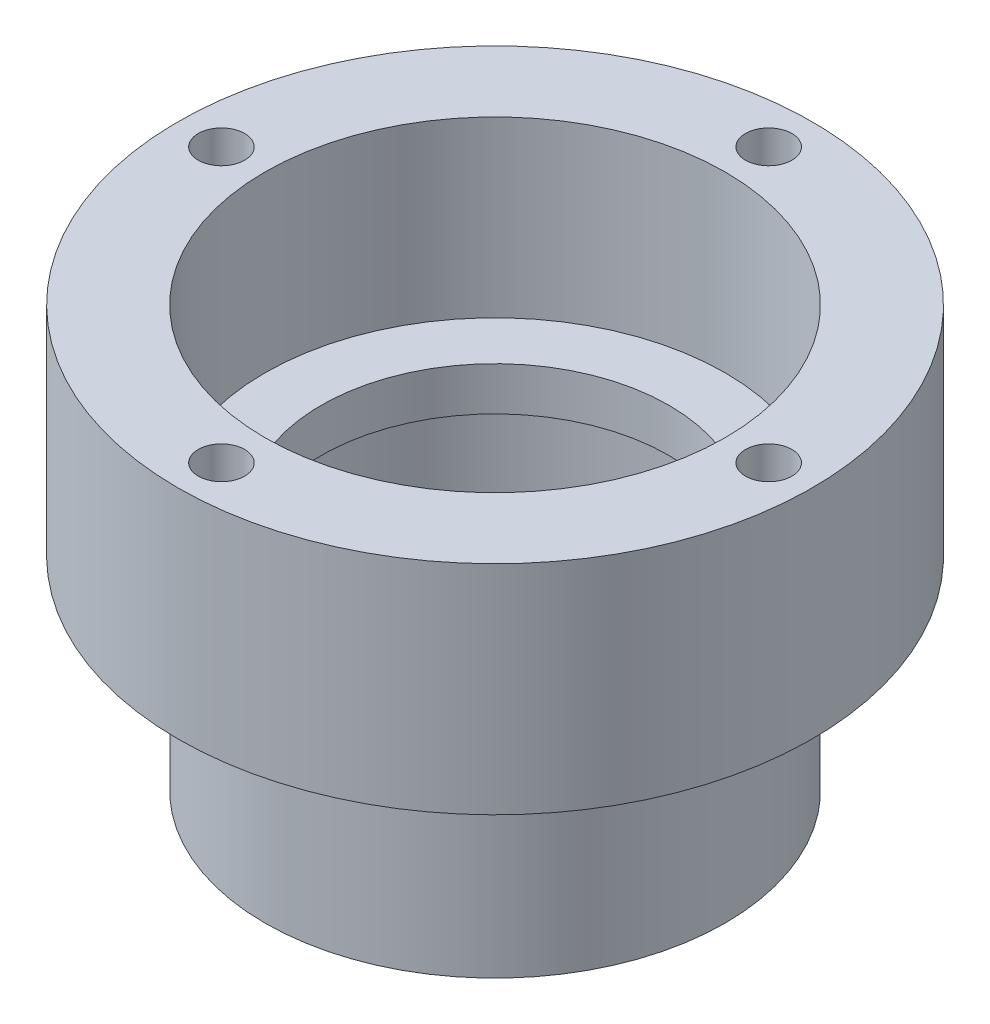
from build123d import *

# Parameters (mm, degrees)
SKETCH1_R                      = 7.9375
SKETCH1_R_2                    = 6.9375
BOSS_EXTRUDE1_DEPTH            = 7
SKETCH2_R                      = 7.9375
SKETCH2_R_2                    = 6
BOSS_EXTRUDE2_DEPTH            = 1.5
SKETCH3_R                      = 10.9375
SKETCH3_R_2                    = 7.9375
BOSS_EXTRUDE3_DEPTH            = 6
M2X0_4_TAPPED_HOLE1_AT_2_COUNT = 2
M2X0_4_TAPPED_HOLE1_AT_2_PITCH = 13.346640495
M2X0_4_TAPPED_HOLE1_AT_3_COUNT = 2
M2X0_4_TAPPED_HOLE1_AT_3_PITCH = 18.875
M2X0_4_TAPPED_HOLE1_AT_4_COUNT = 2
M2X0_4_TAPPED_HOLE1_AT_4_PITCH = 13.346640495
BOSS_EXTRUDE4_START            = 1.5
SKETCH7_R                      = 10.9375
SKETCH7_R_2                    = 6.9375
BOSS_EXTRUDE4_DEPTH            = 1.5


with BuildPart() as part:
    # Sketch1 → Boss-Extrude1 (new body)
    with BuildSketch(Plane(origin=(0, 0, 0), x_dir=(1, 0, 0), z_dir=(0, 1, 0))):
        with Locations(Location((0, 0, 0), (0, 0, 270))):
            Circle(SKETCH1_R)
        with Locations(Location((0, 0, 0), (0, 0, 270))):
            Circle(SKETCH1_R_2, mode=Mode.SUBTRACT)
    extrude(amount=BOSS_EXTRUDE1_DEPTH)

    # Sketch2 → Boss-Extrude2 (add)
    with BuildSketch(Plane(origin=(0, 7, 0), x_dir=(1, 0, 0), z_dir=(0, 1, 0))):
        with Locations(Location((0, 0, 0), (0, 0, 270))):
            Circle(SKETCH2_R)
        with Locations(Location((0, 0, 0), (0, 0, 270))):
            Circle(SKETCH2_R_2, mode=Mode.SUBTRACT)
    extrude(amount=BOSS_EXTRUDE2_DEPTH)



with BuildPart() as body_2:
    # Sketch3 → Boss-Extrude3 (new body)
    with BuildSketch(Plane(origin=(0, 8.5, 0), x_dir=(1, 0, 0), z_dir=(0, 1, 0))):
        with Locations(Location((0, 0, 0), (0, 0, 270))):
            Circle(SKETCH3_R)
        with Locations(Location((0, 0, 0), (0, 0, 270))):
            Circle(SKETCH3_R_2, mode=Mode.SUBTRACT)
    extrude(amount=BOSS_EXTRUDE3_DEPTH)

    # Sketch5 → M2x0.4 Tapped Hole1 (revolve, cut)
    with BuildSketch(Plane(origin=(0, 14.5, -9.4375), x_dir=(0, 0, 1), z_dir=(1, 0, 0))):
        Polygon((0, 0), (0, 6.180688495), (0.8, 5.7), (0.8, 0), align=None)
    m2x0_4_tapped_hole1 = revolve(axis=Axis((0, 20.85, -9.4375), (0, -1, 0)), mode=Mode.SUBTRACT)

    # M2x0.4 Tapped Hole1 at 2: M2x0.4 Tapped Hole1 ×2
    with Locations(*[Vector(0.7071067811865476, 0, 0.7071067811865476) * (i * M2X0_4_TAPPED_HOLE1_AT_2_PITCH) for i in range(1, M2X0_4_TAPPED_HOLE1_AT_2_COUNT)]):
        add(m2x0_4_tapped_hole1, mode=Mode.SUBTRACT)

    # M2x0.4 Tapped Hole1 at 3: M2x0.4 Tapped Hole1 ×2
    with Locations(*[(0, 0, i * M2X0_4_TAPPED_HOLE1_AT_3_PITCH) for i in range(1, M2X0_4_TAPPED_HOLE1_AT_3_COUNT)]):
        add(m2x0_4_tapped_hole1, mode=Mode.SUBTRACT)

    # M2x0.4 Tapped Hole1 at 4: M2x0.4 Tapped Hole1 ×2
    with Locations(*[Vector(-0.7071067811865476, 0, 0.7071067811865476) * (i * M2X0_4_TAPPED_HOLE1_AT_4_PITCH) for i in range(1, M2X0_4_TAPPED_HOLE1_AT_4_COUNT)]):
        add(m2x0_4_tapped_hole1, mode=Mode.SUBTRACT)


with BuildPart() as part_1:
    add(part.part)

    add(body_2.part)  # Boss-Extrude4 merges body 2
    # Sketch7 → Boss-Extrude4 (add)
    with BuildSketch(Plane.XZ.offset(-8.5).offset(BOSS_EXTRUDE4_START)):
        with Locations(Location((0, 0, 0), (0, 0, 90))):
            Circle(SKETCH7_R)
        with Locations(Location((0, 0, 0), (0, 0, 90))):
            Circle(SKETCH7_R_2, mode=Mode.SUBTRACT)
    extrude(amount=-BOSS_EXTRUDE4_DEPTH)


solid = part_1.part
